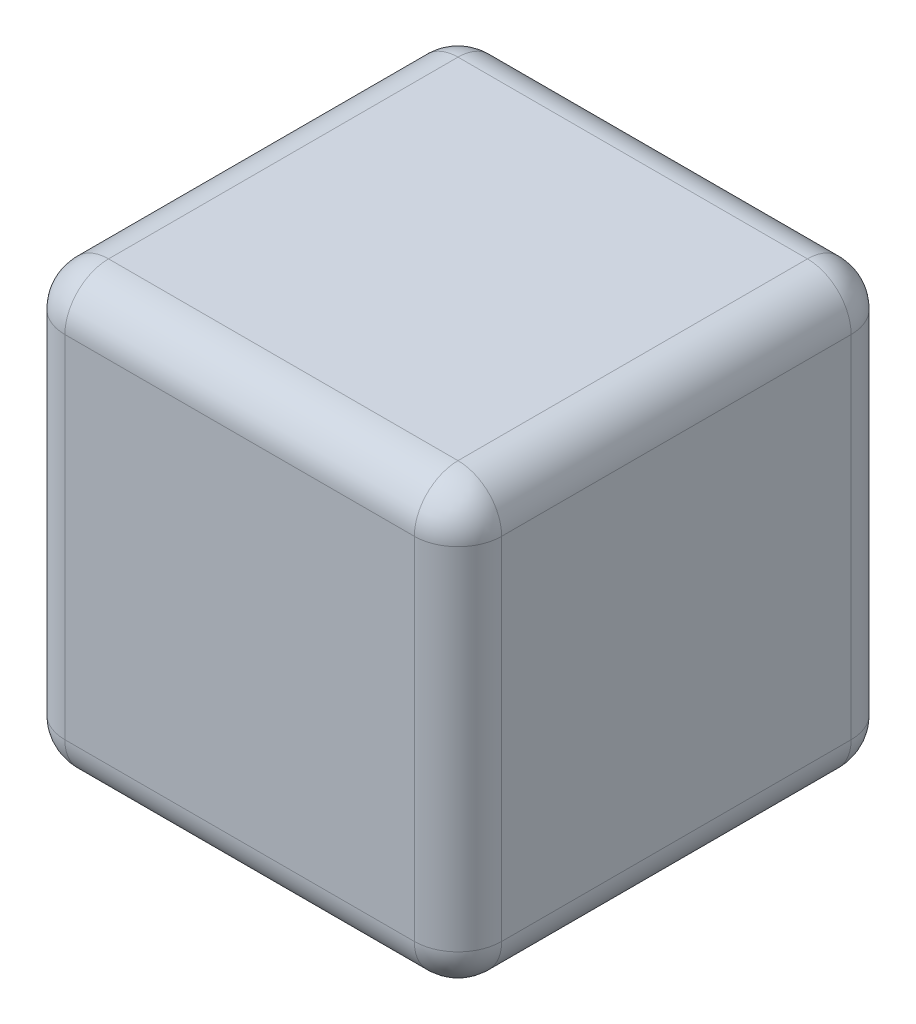
from build123d import *

# Parameters (mm, degrees)
SKETCH1_W           = 20
SKETCH1_H           = 19.999999878
BOSS_EXTRUDE1_DEPTH = 20.066
FILLET1_R           = 2


with BuildPart() as part:
    # Sketch1 → Boss-Extrude1 (new body)
    with BuildSketch(Plane(origin=(0, 0, 0), x_dir=(1, 0, 0), z_dir=(0, 1, 0))):
        with Locations((-10, 9.999999939)):
            Rectangle(SKETCH1_W, SKETCH1_H)
    extrude(amount=BOSS_EXTRUDE1_DEPTH)

    # Fillet1
    fillet1_edges = [part.edges().sort_by_distance(p)[0] for p in [
        (-10, 20.066, -19.999999878),
        (0, 20.066, -9.999999939),
        (-10, 20.066, 0),
        (0, 0, -9.999999939),
        (-10, 0, -19.999999878),
        (-20, 0, -9.999999939),
        (-10, 0, 0),
        (0, 10.033, 0),
        (0, 10.033, -19.999999878),
        (-20, 10.033, -19.999999878),
        (-20, 10.033, 0),
        (-20, 20.066, -9.999999939),
    ]]
    fillet(fillet1_edges, radius=FILLET1_R)


solid = part.part
